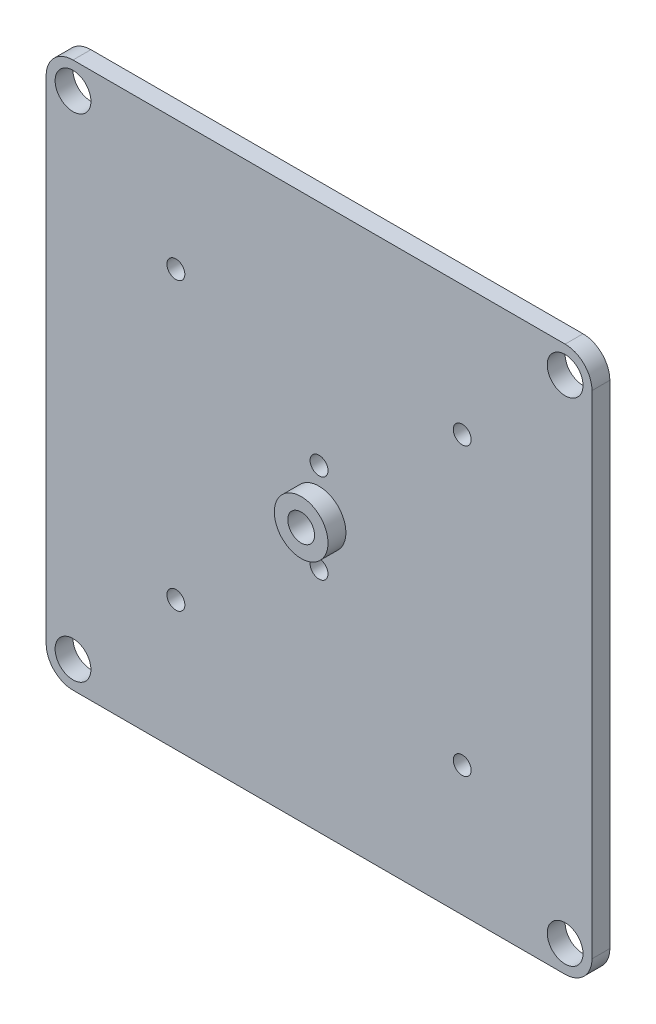
from build123d import *

# Parameters (mm, degrees)
ESQUISSE1_W              = 305
ESQUISSE1_H              = 305
BOSS_EXTRU_1_DEPTH       = 10
ESQUISSE2_R              = 10
ENL_V_MAT_EXTRU_10_DEPTH = 10
CONG_2_R                 = 15
ESQUISSE3_R              = 5
ENL_V_MAT_EXTRU_11_DEPTH = 10
ESQUISSE4_R              = 15
BOSS_EXTRU_2_DEPTH       = 10
ESQUISSE5_R              = 7.5
ENL_V_MAT_EXTRU_12_DEPTH = 20
ESQUISSE6_R              = 5
ENL_V_MAT_EXTRU_13_DEPTH = 10


with BuildPart() as part:
    # Esquisse1 → Boss.-Extru.1 (new body)
    with BuildSketch(Plane.XY):
        Rectangle(ESQUISSE1_W, ESQUISSE1_H)
    extrude(amount=BOSS_EXTRU_1_DEPTH)

    # Esquisse2 → Enlèv. mat.-Extru.10 (cut)
    with BuildSketch(Plane.XY.offset(10)):
        with Locations((137.5, 137.5)):
            Circle(ESQUISSE2_R)
        with Locations((137.5, -137.5)):
            Circle(ESQUISSE2_R)
        with Locations((-137.5, -137.5)):
            Circle(ESQUISSE2_R)
        with Locations((-137.5, 137.5)):
            Circle(ESQUISSE2_R)
    extrude(amount=-ENL_V_MAT_EXTRU_10_DEPTH, mode=Mode.SUBTRACT)

    # Congé2
    cong_2_edges = [part.edges().sort_by_distance(p)[0] for p in [
        (-152.5, 152.5, 5),
        (152.5, 152.5, 5),
        (152.5, -152.5, 5),
        (-152.5, -152.5, 5),
    ]]
    fillet(cong_2_edges, radius=CONG_2_R)

    # Esquisse3 → Enlèv. mat.-Extru.11 (cut)
    with BuildSketch(Plane.XY.offset(10)):
        with Locations((80, 80)):
            Circle(ESQUISSE3_R)
        with Locations((80, -80)):
            Circle(ESQUISSE3_R)
        with Locations((-80, -80)):
            Circle(ESQUISSE3_R)
        with Locations((-80, 80)):
            Circle(ESQUISSE3_R)
    extrude(amount=-ENL_V_MAT_EXTRU_11_DEPTH, mode=Mode.SUBTRACT)

    # Esquisse4 → Boss.-Extru.2 (add)
    with BuildSketch(Plane.XY.offset(10)):
        with Locations(Location((0, 0, 0), (0, 0, 180))):
            Circle(ESQUISSE4_R)
    extrude(amount=BOSS_EXTRU_2_DEPTH)

    # Esquisse5 → Enlèv. mat.-Extru.12 (cut)
    with BuildSketch(Plane.XY.offset(20)):
        Circle(ESQUISSE5_R)
    extrude(amount=-ENL_V_MAT_EXTRU_12_DEPTH, mode=Mode.SUBTRACT)

    # Esquisse6 → Enlèv. mat.-Extru.13 (cut)
    with BuildSketch(Plane.XY.offset(10)):
        with Locations((0, 25)):
            Circle(ESQUISSE6_R)
        with Locations((0, -25)):
            Circle(ESQUISSE6_R)
    extrude(amount=-ENL_V_MAT_EXTRU_13_DEPTH, mode=Mode.SUBTRACT)


solid = part.part
